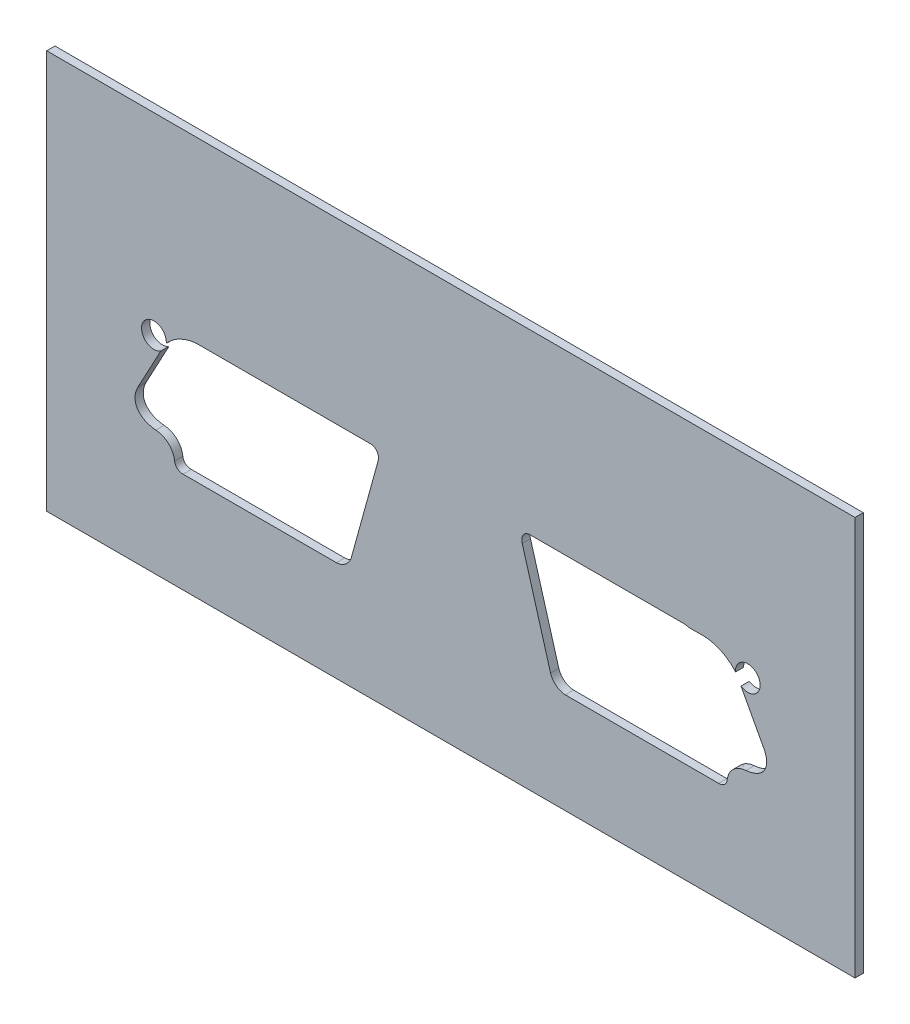
from build123d import *

# Parameters (mm, degrees)
EXTRUDE_1_DEPTH     = 1
CUT_EXTRUDE_4_DEPTH = 54.935146241
SKETCH_4_R          = 1.5
CUT_EXTRUDE_5_DEPTH = 54.935146241
CUT_EXTRUDE1_START  = -1
CUT_EXTRUDE1_DEPTH  = 1
SKETCH4_W           = 98
SKETCH4_H           = 10
BOSS_EXTRUDE1_DEPTH = 1


with BuildPart() as part:
    # Эскиз1 → Бобышка-Вытянуть1 (new body)
    with BuildSketch(Plane.XY):
        Polygon((-49, 5.839183832), (-49, -22.516660498), (49, -22.516660498), (49, 5.839183832), (49, 15.839183832), (-49, 15.839183832), align=None)
    extrude(amount=EXTRUDE_1_DEPTH)

    # Эскиз2 → Вырез-Вытянуть4 (cut, through all)
    with BuildSketch(Plane(origin=(0, 0, 0), x_dir=(-1, 0, 0), z_dir=(0, 0, -1))):
        with BuildLine():
            Line((27.226146034, -9.122134253), (15.739905482, -9.122134253))
            ThreePointArc((15.739905482, -9.122134253), (15.10500819, -9.461530461), (14.917793913, -10.156681647))
            Line((14.917793913, -10.156681647), (17.442090319, -18.930924047))
            ThreePointArc((17.442090319, -18.930924047), (18.050493328, -19.909298147), (19.122649731, -20.331021695))
            Line((19.122649731, -20.331021695), (30.826843589, -20.331021695))
            ThreePointArc((30.826843589, -20.331021695), (31.459345435, -19.990005133), (31.64325008, -19.295361367))
            Line((31.64325008, -19.295361367), (29.100959308, -10.488607797))
            ThreePointArc((29.100959308, -10.488607797), (28.40806584, -9.469896887), (27.226146034, -9.122134253))
        make_face()
        with BuildLine():
            Line((-31.64325008, -19.295361367), (-29.100959308, -10.488607797))
            ThreePointArc((-29.100959308, -10.488607797), (-28.40806584, -9.469896887), (-27.226146034, -9.122134253))
            Line((-27.226146034, -9.122134253), (-15.739905482, -9.122134253))
            ThreePointArc((-15.739905482, -9.122134253), (-15.10500819, -9.461530461), (-14.917793913, -10.156681647))
            Line((-14.917793913, -10.156681647), (-17.442090319, -18.930924047))
            ThreePointArc((-17.442090319, -18.930924047), (-18.050493328, -19.909298147), (-19.122649731, -20.331021695))
            Line((-19.122649731, -20.331021695), (-30.826843589, -20.331021695))
            ThreePointArc((-30.826843589, -20.331021695), (-31.459345435, -19.990005133), (-31.64325008, -19.295361367))
        make_face()
    extrude(amount=-CUT_EXTRUDE_4_DEPTH, mode=Mode.SUBTRACT)

    # Эскиз4 → Вырез-Вытянуть5 (cut, through all)
    with BuildSketch(Plane(origin=(0, 0, 0), x_dir=(-1, 0, 0), z_dir=(0, 0, -1))):
        with Locations((36, -7.524952718)):
            Circle(SKETCH_4_R)
        with Locations((-36, -7.524952718)):
            Circle(SKETCH_4_R)
    extrude(amount=-CUT_EXTRUDE_5_DEPTH, mode=Mode.SUBTRACT)

    # Sketch3 → Cut-Extrude1 (cut)
    with BuildSketch(Plane.XY.offset(1).offset(CUT_EXTRUDE1_START)):
        with BuildLine():
            Line((8.652344227, -7.068131311), (12.085677561, -18.961546856))
            add(Edge.make_bspline(
                [(12.085677561, -18.961546856), (12.485677561, -20.347187502), (13.871318207, -20.347187502)],
                knots=[0.857071948, 0.857071948, 0.857071948, 2.427868275, 2.427868275, 2.427868275], degree=2, weights=[1, 0.707106781, 1]))
            Line((13.871318207, -20.347187502), (32.461996875, -20.347187502))
            add(Edge.make_bspline(
                [(32.461996875, -20.347187502), (33.393769403, -20.347187502), (33.496157418, -19.484255682)],
                knots=[2.427868275, 2.427868275, 2.427868275, 3.611858299, 3.611858299, 3.611858299], degree=2, weights=[1, 0.829829079, 1]))
            add(Edge.make_bspline(
                [(33.496157418, -19.484255682), (33.529743577, -19.201189685), (33.607326061, -18.923570429), (33.853252735, -18.417152493), (34.025349409, -18.183932413), (34.436238564, -17.8036127), (34.681879478, -17.649935655), (35.200024528, -17.435065661), (35.479061866, -17.369439067), (35.76148791, -17.34207634)],
                knots=[0, 0, 0, 0, 0.25, 0.25, 0.5, 0.5, 0.75, 0.75, 1, 1, 1, 1], degree=3))
            add(Edge.make_bspline(
                [(35.76148791, -17.34207634), (36.181169226, -17.301415694), (36.592378309, -17.212108423), (37.170380488, -16.959028015), (37.354968395, -16.854344533), (37.687544868, -16.599797528), (37.83830967, -16.446579579), (38.076557482, -16.101495837), (38.166209489, -15.905573827), (38.271501218, -15.499696694), (38.288800836, -15.285469364), (38.263278752, -14.867475934), (38.220734772, -14.657932914), (38.094284502, -14.258193956), (38.010543981, -14.065974434), (37.910619322, -13.879789794)],
                knots=[0, 0, 0, 0, 0.25, 0.25, 0.375, 0.375, 0.5, 0.5, 0.625, 0.625, 0.75, 0.75, 0.875, 0.875, 1, 1, 1, 1], degree=3))
            Line((37.910619322, -13.879789794), (35.170885606, -8.774980446))
            ThreePointArc((35.170885606, -8.774980446), (34.803783463, -8.429975368), (34.571610551, -7.982886756))
            ThreePointArc((34.571610551, -7.982886756), (34.527886571, -7.812845152), (34.504331156, -7.638859302))
            add(Edge.make_bspline(
                [(34.504331156, -7.638859302), (33.03670289, -5.782259548), (30.630891119, -5.783194379)],
                knots=[4.00651056, 4.00651056, 4.00651056, 5.38030343, 5.38030343, 5.38030343], degree=2, weights=[1, 0.773217832, 1]))
            Line((30.630891119, -5.783194379), (28.778313515, -5.783914238))
            add(Edge.make_bspline(
                [(28.778313515, -5.783914238), (28.498733332, -5.682490665), (28.228663541, -5.682490665)],
                knots=[5.18447533, 5.18447533, 5.18447533, 5.569460928, 5.569460928, 5.569460928], degree=2, weights=[1, 0.981530397, 1]))
            Line((28.228663541, -5.682490665), (9.637984874, -5.682490665))
            add(Edge.make_bspline(
                [(9.637984874, -5.682490665), (8.252344227, -5.682490665), (8.652344227, -7.068131311)],
                knots=[5.569460928, 5.569460928, 5.569460928, 7.140257255, 7.140257255, 7.140257255], degree=2, weights=[1, 0.707106781, 1]))
        make_face()
        with BuildLine():
            Line((-35.170885606, -8.774980446), (-37.925052204, -13.906681863))
            add(Edge.make_bspline(
                [(-37.925052204, -13.906681863), (-38.025225081, -14.093328995), (-38.109806595, -14.28778394), (-38.235924368, -14.687324932), (-38.278394681, -14.895918794), (-38.297414091, -15.212202185), (-38.296322734, -15.317469634), (-38.277441195, -15.527644209), (-38.259343447, -15.633280004), (-38.205994928, -15.836909506), (-38.170798519, -15.935630825), (-38.082894213, -16.126717018), (-38.029532599, -16.219817403), (-37.849055501, -16.479499021), (-37.698892817, -16.631115336), (-37.362837335, -16.886481906), (-37.179664999, -16.989484869), (-36.595923377, -17.242719775), (-36.186794345, -17.329699001), (-35.766265682, -17.369273893)],
                knots=[0, 0, 0, 0, 0.125, 0.125, 0.25, 0.25, 0.3125, 0.3125, 0.375, 0.375, 0.4375, 0.4375, 0.5, 0.5, 0.625, 0.625, 0.75, 0.75, 1, 1, 1, 1], degree=3))
            add(Edge.make_bspline(
                [(-33.495182661, -19.492227082), (-33.738478544, -17.560103824), (-35.766265682, -17.369273893)],
                knots=[5.81913938, 5.81913938, 5.81913938, 6.905546226, 6.905546226, 6.905546226], degree=2, weights=[1, 0.856057288, 1]))
            add(Edge.make_bspline(
                [(-33.495182661, -19.492227082), (-33.387524752, -20.347187502), (-32.461996875, -20.347187502)],
                knots=[2.677546726, 2.677546726, 2.677546726, 3.855317033, 3.855317033, 3.855317033], degree=2, weights=[1, 0.83156042, 1]))
            Line((-32.461996875, -20.347187502), (-13.871318207, -20.347187502))
            add(Edge.make_bspline(
                [(-13.871318207, -20.347187502), (-12.46794332, -20.347187502), (-12.080702928, -18.943926093)],
                knots=[3.855317033, 3.855317033, 3.855317033, 5.438830393, 5.438830393, 5.438830393], degree=2, weights=[1, 0.702596367, 1]))
            Line((-12.080702928, -18.943926093), (-8.83075434, -7.166932971))
            add(Edge.make_bspline(
                [(-8.83075434, -7.166932971), (-8.45309236, -5.798381309), (-9.82190813, -5.798913193)],
                knots=[5.438830393, 5.438830393, 5.438830393, 6.997298301, 6.997298301, 6.997298301], degree=2, weights=[1, 0.711452073, 1]))
            Line((-9.82190813, -5.798913193), (-30.645016113, -5.807004464))
            add(Edge.make_bspline(
                [(-30.645016113, -5.807004464), (-33.032902471, -5.807932329), (-34.505069218, -7.648167801)],
                knots=[0.90305787, 0.90305787, 0.90305787, 2.269113721, 2.269113721, 2.269113721], degree=2, weights=[1, 0.775665219, 1]))
            ThreePointArc((-34.505069218, -7.648167801), (-34.53118454, -7.829224215), (-34.579145022, -8.005755309))
            ThreePointArc((-34.579145022, -8.005755309), (-34.811085633, -8.43954696), (-35.170885606, -8.774980446))
        make_face()
    extrude(amount=CUT_EXTRUDE1_DEPTH, mode=Mode.SUBTRACT)

    # Sketch4 → Boss-Extrude1 (add)
    with BuildSketch(Plane.XY.offset(1)):
        with Locations((0, -27.516660498)):
            Rectangle(SKETCH4_W, SKETCH4_H)
    extrude(amount=-BOSS_EXTRUDE1_DEPTH)


solid = part.part
